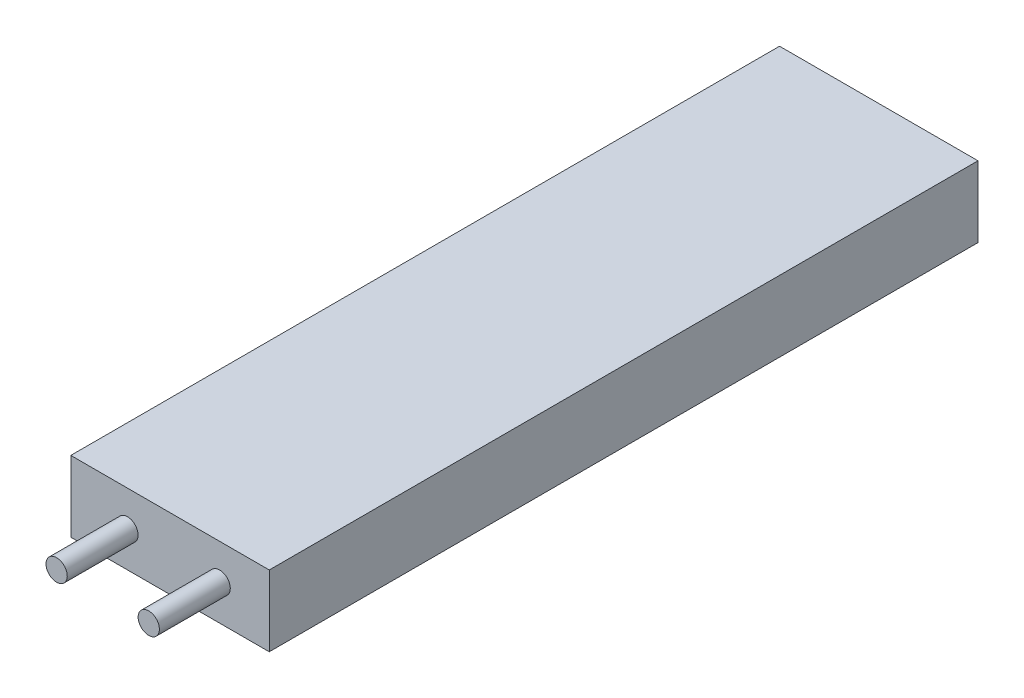
from build123d import *

# Parameters (mm, degrees)
SKETCH1_W           = 14
SKETCH1_H           = 50
BOSS_EXTRUDE1_DEPTH = 5
SKETCH2_R           = 0.75
BOSS_EXTRUDE2_DEPTH = 5


with BuildPart() as part:
    # Sketch1 → Boss-Extrude1 (new body)
    with BuildSketch(Plane(origin=(0, 0, 0), x_dir=(1, 0, 0), z_dir=(0, 1, 0))):
        Rectangle(SKETCH1_W, SKETCH1_H)
    extrude(amount=BOSS_EXTRUDE1_DEPTH)

    # Sketch2 → Boss-Extrude2 (add)
    with BuildSketch(Plane.XY.offset(25)):
        with Locations(Location((-3, 2.5, 0), (0, 0, 180))):
            Circle(SKETCH2_R)
        with Locations(Location((3.5, 2.5, 0), (0, 0, 180))):
            Circle(SKETCH2_R)
    extrude(amount=BOSS_EXTRUDE2_DEPTH)


solid = part.part
